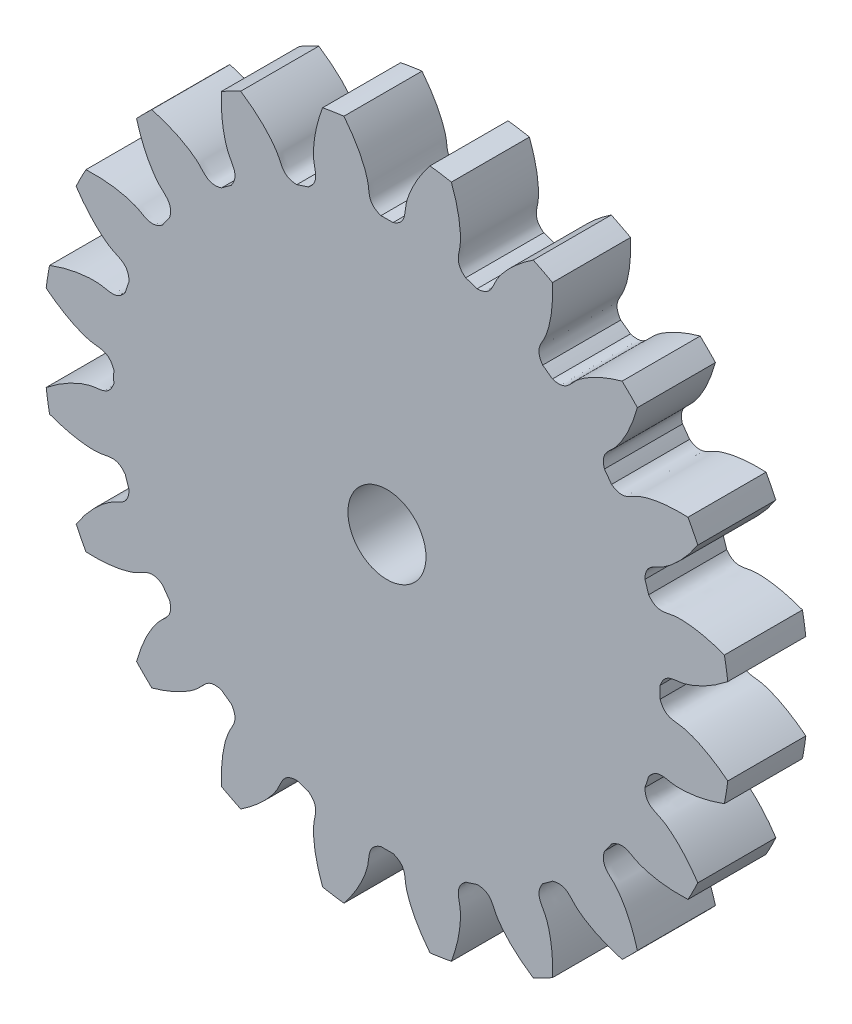
from build123d import *

# Parameters (mm, degrees)
SKETCH_1_R               = 44
EXTRUDE_1_DEPTH          = 10
CUT_EXTRUDE_1_DEPTH      = 64.023805026
PATTERN_CIRCULAR_1_COUNT = 20
SKETCH_4_R               = 5
CUT_EXTRUDE_2_DEPTH      = 10


with BuildPart() as part:
    # 草图1 → 凸台-拉伸1 (new body)
    with BuildSketch(Plane.XY):
        Circle(SKETCH_1_R)
    extrude(amount=EXTRUDE_1_DEPTH)

    # 草图2 → 切除-拉伸1 (cut, through all)
    with BuildSketch(Plane.XY):
        with BuildLine():
            ThreePointArc((0.773266402, 34.991456944), (0, 35), (-0.773266402, 34.991456944))
            add(Edge.make_bspline(
                [(-0.773266402, 34.991456944), (-2.444757619, 35.573902048), (-2.228336397, 36.748454796), (-2.451588226, 37.88003761), (-2.475568745, 37.990226456), (-2.505243559, 38.114538461), (-2.541168388, 38.252787344), (-2.583916561, 38.404765987), (-2.63404822, 38.570251312), (-2.692119486, 38.749002932), (-2.758679, 38.940763788), (-2.834268399, 39.145260181), (-2.919421594, 39.362202002), (-3.014664409, 39.591282923), (-3.120514125, 39.832180606), (-3.237479058, 40.084556926), (-3.366058134, 40.348058203), (-3.506740467, 40.622315445), (-3.660004954, 40.906944599), (-3.826319863, 41.201546816), (-4.006142438, 41.505708724), (-4.199918505, 41.819002711), (-4.408082086, 42.140987222), (-4.631055023, 42.471207055), (-4.869246604, 42.809193681), (-5.123053203, 43.154465562), (-5.392857922, 43.506528483), (-5.679030247, 43.86487589), (-5.981925706, 44.228989246), (-6.301885541, 44.598338378), (-6.639236386, 44.972381851), (-6.994289955, 45.35056734), (-7.367342737, 45.73233201), (-7.758675705, 46.117102908), (-8.168554026, 46.504297358), (-8.597226794, 46.893323369), (-9.044926758, 47.283580044), (-9.511870073, 47.674457997), (-9.998256047, 48.065339784), (-10.504266937, 48.455600326), (-11.030067598, 48.84460736), (-11.765894363, 49.366559471), (-12.33572965, 49.745330404), (-12.724631927, 49.993007439)],
                knots=[0, 0, 0, 0, 0.165916003, 0.170905922, 0.176663519, 0.183188797, 0.190481754, 0.198542391, 0.207370708, 0.216966704, 0.22733038, 0.238461736, 0.250360771, 0.263027487, 0.276461881, 0.290663956, 0.30563371, 0.321371144, 0.337876258, 0.355149051, 0.373189524, 0.391997677, 0.411573509, 0.431917021, 0.453028213, 0.474907084, 0.497553636, 0.520967867, 0.545149777, 0.570099367, 0.595816637, 0.622301587, 0.649554216, 0.677574526, 0.706362514, 0.735918183, 0.766241531, 0.797332559, 0.829191267, 0.861817654, 0.895211721, 0.929373468, 1, 1, 1, 1], degree=3))
            ThreePointArc((-12.724631927, 49.993007439), (0, 51.586985282), (12.724631927, 49.993007439))
            add(Edge.make_bspline(
                [(0.773266402, 34.991456944), (2.444757619, 35.573902048), (2.228336397, 36.748454796), (2.451588226, 37.88003761), (2.475568745, 37.990226456), (2.505243559, 38.114538461), (2.541168388, 38.252787344), (2.583916561, 38.404765987), (2.63404822, 38.570251312), (2.692119486, 38.749002932), (2.758679, 38.940763788), (2.834268399, 39.145260181), (2.919421594, 39.362202002), (3.014664409, 39.591282923), (3.120514125, 39.832180606), (3.237479058, 40.084556926), (3.366058134, 40.348058203), (3.506740467, 40.622315445), (3.660004954, 40.906944599), (3.826319863, 41.201546816), (4.006142438, 41.505708724), (4.199918505, 41.819002711), (4.408082086, 42.140987222), (4.631055023, 42.471207055), (4.869246604, 42.809193681), (5.123053203, 43.154465562), (5.392857922, 43.506528483), (5.679030247, 43.86487589), (5.981925706, 44.228989246), (6.301885541, 44.598338378), (6.639236386, 44.972381851), (6.994289955, 45.35056734), (7.367342737, 45.73233201), (7.758675705, 46.117102908), (8.168554026, 46.504297358), (8.597226794, 46.893323369), (9.044926758, 47.283580044), (9.511870073, 47.674457997), (9.998256047, 48.065339784), (10.504266937, 48.455600326), (11.030067598, 48.84460736), (11.765894363, 49.366559471), (12.33572965, 49.745330404), (12.724631927, 49.993007439)],
                knots=[0, 0, 0, 0, 0.165916003, 0.170905922, 0.176663519, 0.183188797, 0.190481754, 0.198542391, 0.207370708, 0.216966704, 0.22733038, 0.238461736, 0.250360771, 0.263027487, 0.276461881, 0.290663956, 0.30563371, 0.321371144, 0.337876258, 0.355149051, 0.373189524, 0.391997677, 0.411573509, 0.431917021, 0.453028213, 0.474907084, 0.497553636, 0.520967867, 0.545149777, 0.570099367, 0.595816637, 0.622301587, 0.649554216, 0.677574526, 0.706362514, 0.735918183, 0.766241531, 0.797332559, 0.829191267, 0.861817654, 0.895211721, 0.929373468, 1, 1, 1, 1], degree=3))
        make_face()
    cut_extrude_1 = extrude(amount=CUT_EXTRUDE_1_DEPTH, mode=Mode.SUBTRACT)

    # 阵列(圆周)1: 切除-拉伸1 ×20 about axis
    pattern_circular_1_axis = Axis((0, 0, -1.5), (0, 0, 1))
    for i in range(1, PATTERN_CIRCULAR_1_COUNT):
        add(cut_extrude_1.rotate(pattern_circular_1_axis, i * 360 / PATTERN_CIRCULAR_1_COUNT), mode=Mode.SUBTRACT)

    # 草图4 → 切除-拉伸2 (cut)
    with BuildSketch(Plane.XY.offset(10)):
        Circle(SKETCH_4_R)
    extrude(amount=-CUT_EXTRUDE_2_DEPTH, mode=Mode.SUBTRACT)


solid = part.part
